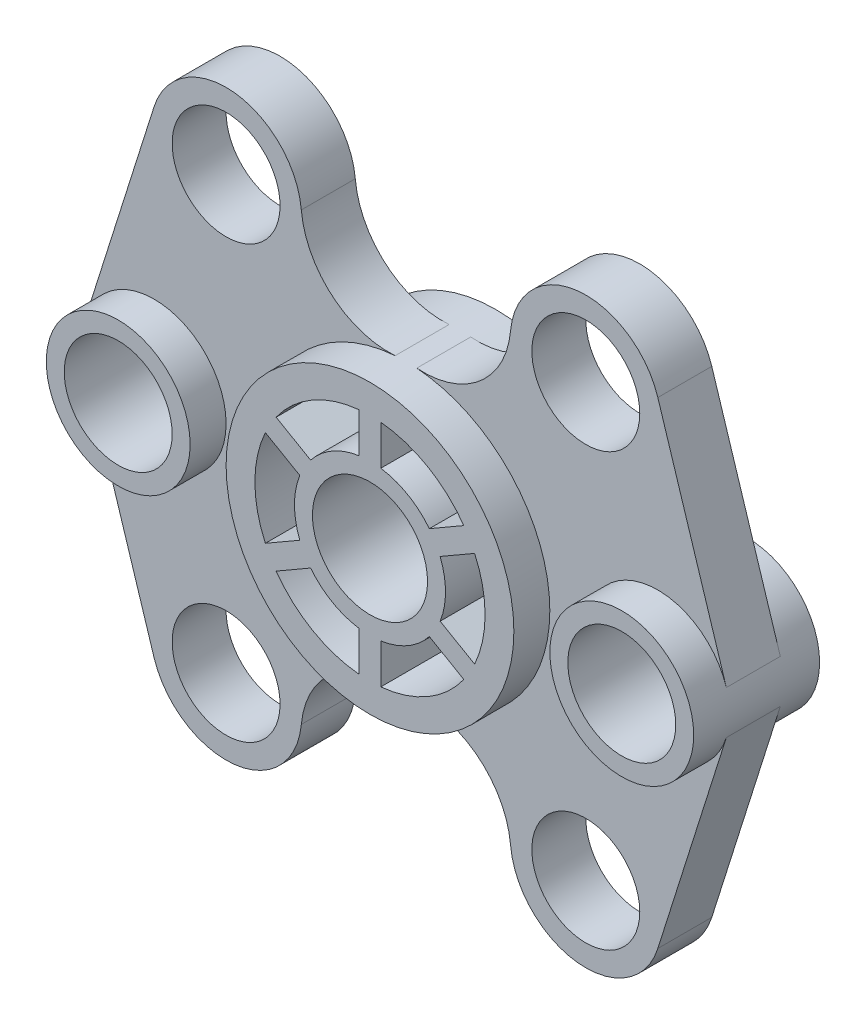
from build123d import *

# Parameters (mm, degrees)
SKETCH1_4_R           = 20
SKETCH1_4_R_2         = 15
BOSS_EXTRUDE2_DEPTH   = 17.5
SKETCH1_4_R_3         = 40
SKETCH1_4_R_4         = 16
BOSS_EXTRUDE2_2_DEPTH = 17.5
BOSS_EXTRUDE2_3_DEPTH = 17.5
SKETCH1_5_R           = 15
BOSS_EXTRUDE3_DEPTH   = 7.5


with BuildPart() as part:
    # Sketch1<4> → Boss-Extrude2 (new, symmetric)
    with BuildSketch(Plane.XY):
        with Locations((70, 0)):
            Circle(SKETCH1_4_R)
        with Locations((70, 0)):
            Circle(SKETCH1_4_R_2, mode=Mode.SUBTRACT)
    extrude(amount=BOSS_EXTRUDE2_DEPTH, both=True)



with BuildPart() as body_2:
    # Sketch1<4> → Boss-Extrude2 2 (new, symmetric)
    with BuildSketch(Plane.XY):
        Circle(SKETCH1_4_R_3)
        with BuildLine():
            ThreePointArc((-3, -31.859064644), (-16, -27.712812921), (-26.090759323, -18.527608533))
            Line((-26.090759323, -18.527608533), (-16.5, -12.990381057))
            ThreePointArc((-16.5, -12.990381057), (-10.5, -18.186533479), (-3, -20.784609691))
            Line((-3, -20.784609691), (-3, -31.859064644))
        make_face(mode=Mode.SUBTRACT)
        with BuildLine():
            ThreePointArc((26.090759323, -18.527608533), (16, -27.712812921), (3, -31.859064644))
            Line((3, -31.859064644), (3, -20.784609691))
            ThreePointArc((3, -20.784609691), (10.5, -18.186533479), (16.5, -12.990381057))
            Line((16.5, -12.990381057), (26.090759323, -18.527608533))
        make_face(mode=Mode.SUBTRACT)
        with BuildLine():
            Line((29.090759323, -13.331456111), (19.5, -7.794228634))
            ThreePointArc((19.5, -7.794228634), (21, 0), (19.5, 7.794228634))
            Line((19.5, 7.794228634), (29.090759323, 13.331456111))
            ThreePointArc((29.090759323, 13.331456111), (32, 0), (29.090759323, -13.331456111))
        make_face(mode=Mode.SUBTRACT)
        with BuildLine():
            ThreePointArc((3, 31.859064644), (16, 27.712812921), (26.090759323, 18.527608533))
            Line((26.090759323, 18.527608533), (16.5, 12.990381057))
            ThreePointArc((16.5, 12.990381057), (10.5, 18.186533479), (3, 20.784609691))
            Line((3, 20.784609691), (3, 31.859064644))
        make_face(mode=Mode.SUBTRACT)
        with BuildLine():
            ThreePointArc((-26.090759323, 18.527608533), (-16, 27.712812921), (-3, 31.859064644))
            Line((-3, 31.859064644), (-3, 20.784609691))
            ThreePointArc((-3, 20.784609691), (-10.5, 18.186533479), (-16.5, 12.990381057))
            Line((-16.5, 12.990381057), (-26.090759323, 18.527608533))
        make_face(mode=Mode.SUBTRACT)
        with BuildLine():
            ThreePointArc((-29.090759323, -13.331456111), (-32, 0), (-29.090759323, 13.331456111))
            Line((-29.090759323, 13.331456111), (-19.5, 7.794228634))
            ThreePointArc((-19.5, 7.794228634), (-21, 0), (-19.5, -7.794228634))
            Line((-19.5, -7.794228634), (-29.090759323, -13.331456111))
        make_face(mode=Mode.SUBTRACT)
        Circle(SKETCH1_4_R_4, mode=Mode.SUBTRACT)
    extrude(amount=BOSS_EXTRUDE2_2_DEPTH, both=True)


with BuildPart() as body_3:
    # Sketch1<4> → Boss-Extrude2 3 (new, symmetric)
    with BuildSketch(Plane.XY):
        with Locations((-70, 0)):
            Circle(SKETCH1_4_R)
        with Locations((-70, 0)):
            Circle(SKETCH1_4_R_2, mode=Mode.SUBTRACT)
    extrude(amount=BOSS_EXTRUDE2_3_DEPTH, both=True)


with BuildPart() as part_1:
    add(part.part)

    add(body_2.part)  # Boss-Extrude3 merges body 2

    add(body_3.part)  # Boss-Extrude3 merges body 3
    # Sketch1<5> → Boss-Extrude3 (add, symmetric)
    # profile 1 of 2: a face of its own
    with BuildSketch(Plane.XY):
        with BuildLine():
            Line((70.02485881, -66.324952937), (89.071294105, -6.023764702))
            ThreePointArc((89.071294105, -6.023764702), (50, 0), (89.071294105, 6.023764702))
            Line((89.071294105, 6.023764702), (70.02485881, 66.324952937))
            ThreePointArc((70.02485881, 66.324952937), (47.761832891, 80.880388119), (29.089532552, 61.937098635))
            ThreePointArc((29.089532552, 61.937098635), (20.55564481, 45.574895377), (3, 39.88734135))
            ThreePointArc((3, 39.88734135), (40, 0), (3, -39.88734135))
            ThreePointArc((3, -39.88734135), (20.55564481, -45.574895377), (29.089532552, -61.937098635))
            ThreePointArc((29.089532552, -61.937098635), (47.761832891, -80.880388119), (70.02485881, -66.324952937))
        make_face()
        with Locations((50, -60)):
            Circle(SKETCH1_5_R, mode=Mode.SUBTRACT)
        with Locations((50, 60)):
            Circle(SKETCH1_5_R, mode=Mode.SUBTRACT)
    # profile 2 of 2: a face of its own
    with BuildSketch(Plane.XY):
        with BuildLine():
            ThreePointArc((-29.089532552, -61.937098635), (-20.55564481, -45.574895377), (-3, -39.88734135))
            ThreePointArc((-3, -39.88734135), (-40, 0), (-3, 39.88734135))
            ThreePointArc((-3, 39.88734135), (-20.55564481, 45.574895377), (-29.089532552, 61.937098635))
            ThreePointArc((-29.089532552, 61.937098635), (-47.761832891, 80.880388119), (-70.02485881, 66.324952937))
            Line((-70.02485881, 66.324952937), (-89.071294105, 6.023764702))
            ThreePointArc((-89.071294105, 6.023764702), (-50, 0), (-89.071294105, -6.023764702))
            Line((-89.071294105, -6.023764702), (-70.02485881, -66.324952937))
            ThreePointArc((-70.02485881, -66.324952937), (-47.761832891, -80.880388119), (-29.089532552, -61.937098635))
        make_face()
        with Locations((-50, -60)):
            Circle(SKETCH1_5_R, mode=Mode.SUBTRACT)
        with Locations((-50, 60)):
            Circle(SKETCH1_5_R, mode=Mode.SUBTRACT)
    extrude(amount=BOSS_EXTRUDE3_DEPTH, both=True)


solid = part_1.part
